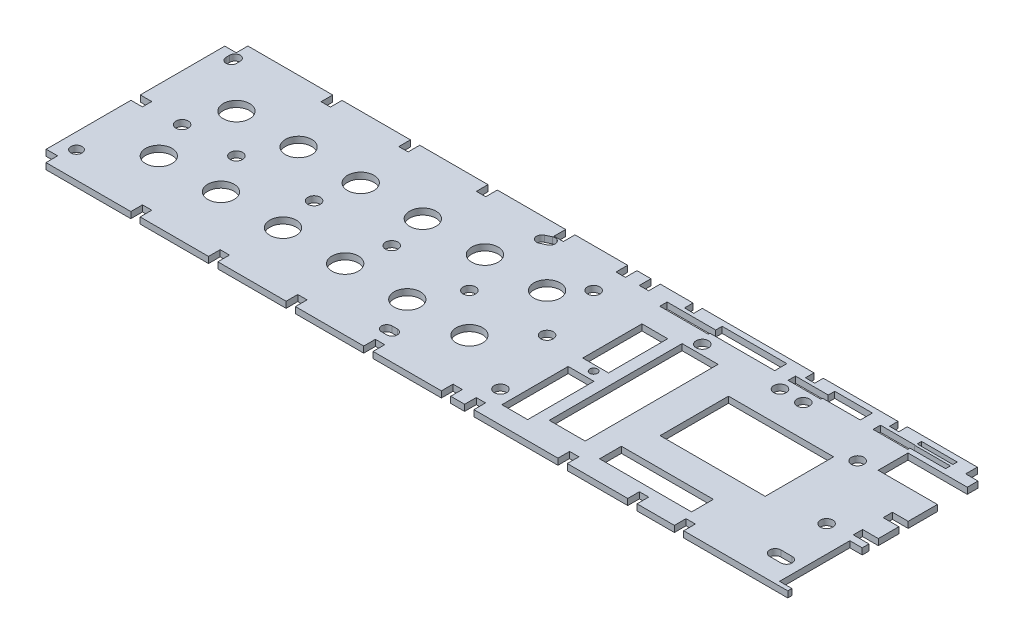
from build123d import *

# Parameters (mm, degrees)
SKETCH1_R           = 3.625773575
SKETCH1_R_2         = 8.5
SKETCH1_R_3         = 4
SKETCH1_W           = 59.227902108
SKETCH1_H           = 14.048666808
SKETCH1_W_2         = 16.602969863
SKETCH1_H_2         = 42.683012068
SKETCH1_R_4         = 2.466961033
SKETCH1_W_3         = 23.148371443
SKETCH1_H_3         = 85.569152371
SKETCH1_H_4         = 38.143470965
SKETCH1_W_4         = 67.68903098
SKETCH1_H_5         = 44.061727713
SKETCH1_W_5         = 22.994184748
SKETCH1_H_6         = 2.807717578
BOSS_EXTRUDE1_DEPTH = 4


with BuildPart() as part:
    # Sketch1 → Boss-Extrude1 (new body)
    with BuildSketch(Plane(origin=(0, 0, 0), x_dir=(1, 0, 0), z_dir=(0, 1, 0))):
        Polygon((62.002732312, 130), (7.385469745, 130), (7.385469745, 122.5), (0, 122.5), (0, 68.086598687), (7.385469745, 68.086598687), (7.385469745, 62.086598687), (0, 62.086598687), (0, 7.5), (7.385469745, 7.5), (7.385469745, 0), (62.002732312, 0), (62.002732312, 7.5), (68.002732312, 7.5), (68.002732312, 0), (112.032509858, 0), (112.032509858, 7.5), (118.032509858, 7.5), (118.032509858, 0), (161.992021545, 0), (161.992021545, 7.5), (167.992021545, 7.5), (167.992021545, 0), (211.980665765, 0), (211.980665765, 7.5), (217.980665765, 7.5), (217.980665765, 0), (261.969584498, 0), (261.969584498, 7.5), (267.969584498, 7.5), (267.969584498, 0), (276.920755035, 0), (276.920755035, 7.5), (282.920755035, 7.5), (282.920755035, 0), (337.020889406, 0), (337.020889406, 7.5), (343.020889406, 7.5), (343.020889406, 0), (381.96318409, 0), (381.96318409, 7.5), (387.96318409, 7.5), (387.96318409, 0), (411.996997426, 0), (411.996997426, 7.5), (417.996997426, 7.5), (417.996997426, 0), (485, 0), (485, 2.644509449), (477.041499419, 2.644509449), (477.041499419, 47.941310654), (485, 47.941310654), (485, 52.306927402), (474.892633063, 52.306927402), (474.892633063, 58.306927402), (485, 58.306927402), (485, 71.532960334), (474.892633063, 71.532960334), (474.892633063, 77.532960334), (485, 77.532960334), (485, 96.337752746), (446.852106169, 96.337752746), (446.852106169, 115.573963572), (485, 115.573963572), (485, 122.491965735), (477.041499419, 122.491965735), (477.041499419, 130), (431.99827146, 130), (431.99827146, 124.5), (425.99827146, 124.5), (425.99827146, 130), (377.887919693, 130), (377.887919693, 124.5), (371.887919693, 124.5), (371.887919693, 130), (300.000783582, 130), (300.000783582, 124.5), (294.000783582, 124.5), (294.000783582, 130), (272.916462339, 130), (272.916462339, 122.5), (266.916462339, 122.5), (266.916462339, 130), (257.911220927, 130), (257.911220927, 122.5), (251.911220927, 122.5), (251.911220927, 130), (217.980665765, 130), (217.980665765, 122.5), (211.980665765, 122.5), (211.980665765, 130), (167.992021545, 130), (167.992021545, 122.5), (161.992021545, 122.5), (161.992021545, 130), (118.032509858, 130), (118.032509858, 122.5), (112.032509858, 122.5), (112.032509858, 130), (68.002732312, 130), (68.002732312, 122.5), (62.002732312, 122.5), align=None)
        with Locations(Location((10.034738544, 16.986969126, 0), (0, 0, 270))):
            Circle(SKETCH1_R, mode=Mode.SUBTRACT)
        with BuildLine():
            ThreePointArc((209.806870097, 13.639154798), (206.459055769, 16.986969126), (209.806870097, 20.334783454))
            Line((209.806870097, 20.334783454), (213.263594128, 20.334783454))
            ThreePointArc((213.263594128, 20.334783454), (216.611408456, 16.986969126), (213.263594128, 13.639154798))
            Line((213.263594128, 13.639154798), (209.806870097, 13.639154798))
        make_face(mode=Mode.SUBTRACT)
        with Locations(Location((40.013782172, 40.004966614, 0), (0, 0, 270))):
            Circle(SKETCH1_R_2, mode=Mode.SUBTRACT)
        with Locations(Location((80.013782172, 40.004966614, 0), (0, 0, 270))):
            Circle(SKETCH1_R_2, mode=Mode.SUBTRACT)
        with Locations(Location((120.013782172, 40.004966614, 0), (0, 0, 270))):
            Circle(SKETCH1_R_2, mode=Mode.SUBTRACT)
        with Locations(Location((160.013782172, 40.004966614, 0), (0, 0, 270))):
            Circle(SKETCH1_R_2, mode=Mode.SUBTRACT)
        with Locations(Location((200.013782172, 40.004966614, 0), (0, 0, 270))):
            Circle(SKETCH1_R_2, mode=Mode.SUBTRACT)
        with Locations(Location((240.013782172, 40.004966614, 0), (0, 0, 270))):
            Circle(SKETCH1_R_2, mode=Mode.SUBTRACT)
        with Locations(Location((280, 20, 0), (0, 0, 270))):
            Circle(SKETCH1_R_3, mode=Mode.SUBTRACT)
        with Locations((380.411034456, 20.047190056)):
            Rectangle(SKETCH1_W, SKETCH1_H, mode=Mode.SUBTRACT)
        with BuildLine():
            ThreePointArc((460, 13.35335009), (456.366380964, 16.986969126), (460, 20.620588162))
            Line((460, 20.620588162), (467.25387069, 20.620588162))
            ThreePointArc((467.25387069, 20.620588162), (470.887489726, 16.986969126), (467.25387069, 13.35335009))
            Line((467.25387069, 13.35335009), (460, 13.35335009))
        make_face(mode=Mode.SUBTRACT)
        with Locations((297.476007111, 33.087211158)):
            Rectangle(SKETCH1_W_2, SKETCH1_H_2, mode=Mode.SUBTRACT)
        with Locations(Location((300, 60, 0), (0, 0, 270))):
            Circle(SKETCH1_R_4, mode=Mode.SUBTRACT)
        with Locations((324.695299051, 61.075682891)):
            Rectangle(SKETCH1_W_3, SKETCH1_H_3, mode=Mode.SUBTRACT)
        with Locations(Location((460, 50, 0), (0, 0, 270))):
            Circle(SKETCH1_R_3, mode=Mode.SUBTRACT)
        with Locations(Location((30, 65, 0), (0, 0, 270))):
            Circle(SKETCH1_R_3, mode=Mode.SUBTRACT)
        with Locations(Location((65, 65, 0), (0, 0, 270))):
            Circle(SKETCH1_R_3, mode=Mode.SUBTRACT)
        with Locations(Location((115, 65, 0), (0, 0, 270))):
            Circle(SKETCH1_R_3, mode=Mode.SUBTRACT)
        with Locations(Location((40.013782172, 90.004966614, 0), (0, 0, 270))):
            Circle(SKETCH1_R_2, mode=Mode.SUBTRACT)
        with Locations(Location((80.013782172, 90.004966614, 0), (0, 0, 270))):
            Circle(SKETCH1_R_2, mode=Mode.SUBTRACT)
        with Locations(Location((120.013782172, 90.004966614, 0), (0, 0, 270))):
            Circle(SKETCH1_R_2, mode=Mode.SUBTRACT)
        with Locations(Location((165, 65, 0), (0, 0, 270))):
            Circle(SKETCH1_R_3, mode=Mode.SUBTRACT)
        with Locations(Location((215, 65, 0), (0, 0, 270))):
            Circle(SKETCH1_R_3, mode=Mode.SUBTRACT)
        with Locations(Location((160.013782172, 90.004966614, 0), (0, 0, 270))):
            Circle(SKETCH1_R_2, mode=Mode.SUBTRACT)
        with Locations(Location((200.013782172, 90.004966614, 0), (0, 0, 270))):
            Circle(SKETCH1_R_2, mode=Mode.SUBTRACT)
        with Locations(Location((240.013782172, 90.004966614, 0), (0, 0, 270))):
            Circle(SKETCH1_R_2, mode=Mode.SUBTRACT)
        with BuildLine():
            ThreePointArc((6.643144597, 119.0046284), (10.034738544, 122.396222347), (13.426332491, 119.0046284))
            Line((13.426332491, 119.0046284), (13.426332491, 116.692166772))
            ThreePointArc((13.426332491, 116.692166772), (10.034738544, 113.300572824), (6.643144597, 116.692166772))
            Line((6.643144597, 116.692166772), (6.643144597, 119.0046284))
        make_face(mode=Mode.SUBTRACT)
        with BuildLine():
            ThreePointArc((211.80063322, 121.675622046), (216.346514978, 120.055662103), (214.726555036, 115.509780345))
            Line((214.726555036, 115.509780345), (211.23636324, 113.853554186))
            ThreePointArc((211.23636324, 113.853554186), (206.690481482, 115.473514128), (208.310441424, 120.019395887))
            Line((208.310441424, 120.019395887), (211.80063322, 121.675622046))
        make_face(mode=Mode.SUBTRACT)
        with Locations(Location((265, 65, 0), (0, 0, 270))):
            Circle(SKETCH1_R_3, mode=Mode.SUBTRACT)
        with Locations((297.476007111, 82.872796302)):
            Rectangle(SKETCH1_W_2, SKETCH1_H_4, mode=Mode.SUBTRACT)
        with Locations((391.187000473, 67.46144053)):
            Rectangle(SKETCH1_W_4, SKETCH1_H_5, mode=Mode.SUBTRACT)
        with Locations(Location((435, 95, 0), (0, 0, 270))):
            Circle(SKETCH1_R_3, mode=Mode.SUBTRACT)
        with Locations(Location((255, 105, 0), (0, 0, 270))):
            Circle(SKETCH1_R_3, mode=Mode.SUBTRACT)
        with Locations(Location((320, 110, 0), (0, 0, 270))):
            Circle(SKETCH1_R_3, mode=Mode.SUBTRACT)
        Polygon((285.085809199, 117.5), (285.085809199, 122.235411884), (316.334759402, 122.235411884), (316.334759402, 126.4), (358.024535321, 126.4), (358.024535321, 118.592701195), (316.334759402, 118.592701195), (316.334759402, 117.5), align=None, mode=Mode.SUBTRACT)
        with Locations(Location((370, 110, 0), (0, 0, 270))):
            Circle(SKETCH1_R_3, mode=Mode.SUBTRACT)
        with Locations(Location((385, 110, 0), (0, 0, 270))):
            Circle(SKETCH1_R_3, mode=Mode.SUBTRACT)
        Polygon((367.73009162, 117.5), (367.73009162, 122.235411884), (388.832323875, 122.235411884), (388.832323875, 126.4), (413.096214621, 126.4), (413.096214621, 118.592701195), (388.832323875, 118.592701195), (388.832323875, 117.5), align=None, mode=Mode.SUBTRACT)
        Polygon((467.691755373, 118.935538121), (444.73163474, 118.935538121), (444.73163474, 117.5), (422.447958107, 117.5), (422.447958107, 122.235411884), (444.73163474, 122.235411884), (444.73163474, 122.021945082), (467.691755373, 122.021945082), align=None, mode=Mode.SUBTRACT)
        with Locations((456.228727114, 124.996141211)):
            Rectangle(SKETCH1_W_5, SKETCH1_H_6, mode=Mode.SUBTRACT)
    extrude(amount=-BOSS_EXTRUDE1_DEPTH)


solid = part.part
